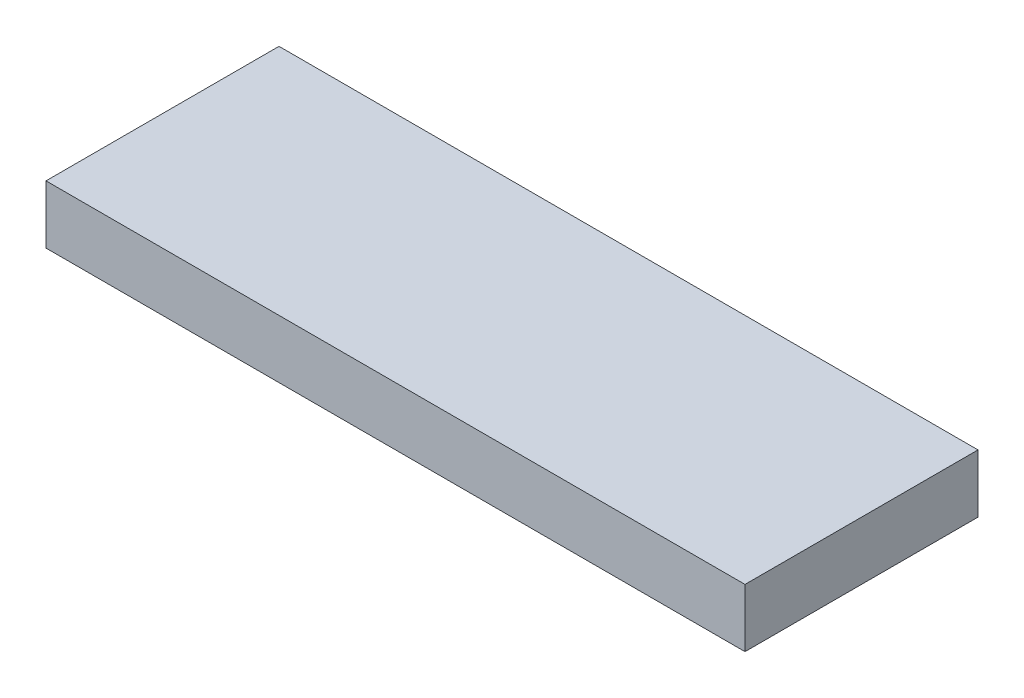
from build123d import *

# Parameters (mm, degrees)
SKETCH1_W           = 457.2
SKETCH1_H           = 152.4
BOSS_EXTRUDE1_DEPTH = 38.1


with BuildPart() as part:
    # Sketch1 → Boss-Extrude1 (new body)
    with BuildSketch(Plane(origin=(0, 0, 0), x_dir=(1, 0, 0), z_dir=(0, 1, 0))):
        Rectangle(SKETCH1_W, SKETCH1_H)
    extrude(amount=BOSS_EXTRUDE1_DEPTH)


solid = part.part
